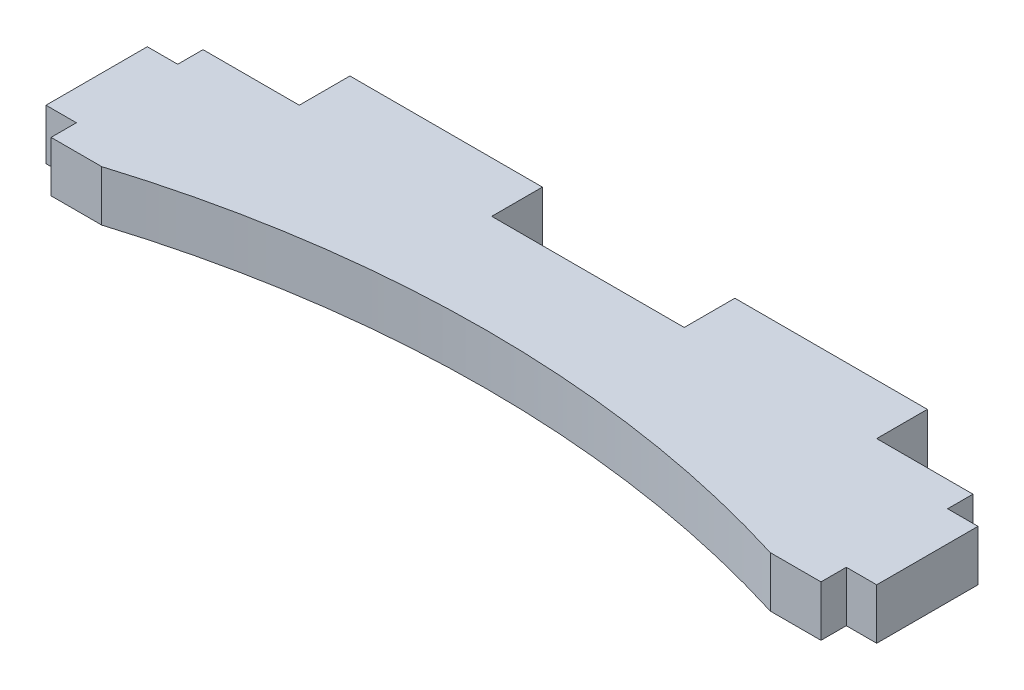
from build123d import *

# Parameters (mm, degrees)
BOSS_EXTRUDE1_DEPTH = 5
CUT_EXTRUDE1_DEPTH  = 44.153794735


with BuildPart() as part:
    # Sketch1 → Boss-Extrude1 (new body)
    with BuildSketch(Plane(origin=(0, 0, 0), x_dir=(1, 0, 0), z_dir=(0, 1, 0))):
        Polygon((-41, -5), (-41, 5), (-38, 5), (-38, 7.5), (-28.5, 7.5), (-28.5, 12.5), (-9.5, 12.5), (-9.5, 7.5), (0, 7.5), (0, -7.5), (-38, -7.5), (-38, -5), align=None)
    boss_extrude1 = extrude(amount=BOSS_EXTRUDE1_DEPTH)

    # Mirror1: Boss-Extrude1 across plane
    add(boss_extrude1.mirror(Plane(origin=(0, 5, -7.5), x_dir=(0, 0, 1), z_dir=(-1, 0, 0))))

    # Sketch4 → Cut-Extrude1 (cut, through all)
    with BuildSketch(Plane(origin=(0, 5, 0), x_dir=(1, 0, 0), z_dir=(0, 1, 0))):
        with BuildLine():
            Line((-33, -7.5), (33, -7.5))
            ThreePointArc((33, -7.5), (0, -2.5), (-33, -7.5))
        make_face()
    extrude(amount=-CUT_EXTRUDE1_DEPTH, mode=Mode.SUBTRACT)


solid = part.part
